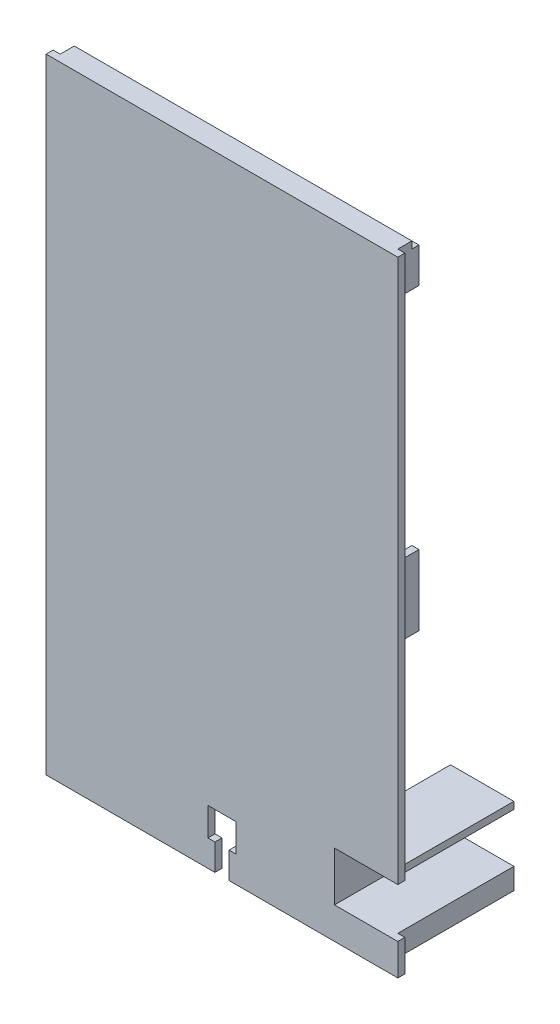
from build123d import *

# Parameters (mm, degrees)
SKETCH1_W           = 100
SKETCH1_H           = 177.5
BOSS_EXTRUDE1_DEPTH = 2
SKETCH3_W           = 2
SKETCH3_H           = 20
BOSS_EXTRUDE2_DEPTH = 6
SKETCH4_W           = 96
SKETCH4_H           = 2
BOSS_EXTRUDE3_DEPTH = 4
BOSS_EXTRUDE5_DEPTH = 33
SKETCH7_W           = 18
SKETCH7_H           = 14
CUT_EXTRUDE2_DEPTH  = 207.386167172
CUT_EXTRUDE3_DEPTH  = 207.386167172


with BuildPart() as part:
    # Sketch1 → Boss-Extrude1 (new body)
    with BuildSketch(Plane.XY):
        with Locations((50, 88.75)):
            Rectangle(SKETCH1_W, SKETCH1_H)
    extrude(amount=BOSS_EXTRUDE1_DEPTH)

    # Sketch3 → Boss-Extrude2 (add)
    with BuildSketch(Plane(origin=(0, 0, 0), x_dir=(-1, 0, 0), z_dir=(0, 0, -1))):
        Polygon((-98, 175.5), (-88, 175.5), (-88, 173.5), (-96, 173.5), (-96, 165.5), (-98, 165.5), align=None)
        Polygon((-12, 175.5), (-2, 175.5), (-2, 165.5), (-4, 165.5), (-4, 173.5), (-12, 173.5), align=None)
        Polygon((-2, 3), (-12, 3), (-12, 5), (-4, 5), (-4, 13), (-2, 13), align=None)
        with Locations((-97, 90.5)):
            Rectangle(SKETCH3_W, SKETCH3_H)
        with Locations((-3, 90.5)):
            Rectangle(SKETCH3_W, SKETCH3_H)
    extrude(amount=BOSS_EXTRUDE2_DEPTH)

    # Sketch4 → Boss-Extrude3 (add)
    with BuildSketch(Plane(origin=(0, 0, 0), x_dir=(-1, 0, 0), z_dir=(0, 0, -1))):
        with Locations((-50, 176.5)):
            Rectangle(SKETCH4_W, SKETCH4_H)
    extrude(amount=BOSS_EXTRUDE3_DEPTH)

    # Sketch5 → Boss-Extrude5 (add)
    with BuildSketch(Plane(origin=(0, 0, 0), x_dir=(-1, 0, 0), z_dir=(0, 0, -1))):
        Polygon((-98, 3), (-80, 3), (-80, 25), (-98, 25), (-98, 23), (-82, 23), (-82, 9), (-98, 9), align=None)
    extrude(amount=BOSS_EXTRUDE5_DEPTH)

    # Sketch7 → Cut-Extrude2 (cut, through all)
    with BuildSketch(Plane(origin=(0, 0, 0), x_dir=(-1, 0, 0), z_dir=(0, 0, -1))):
        with Locations((-91, 16)):
            Rectangle(SKETCH7_W, SKETCH7_H)
    extrude(amount=-CUT_EXTRUDE2_DEPTH, mode=Mode.SUBTRACT)

    # Sketch8 → Cut-Extrude3 (cut, through all)
    with BuildSketch(Plane(origin=(0, 0, 0), x_dir=(-1, 0, 0), z_dir=(0, 0, -1))):
        Polygon((-48, 0), (-48, 7.5), (-46, 7.5), (-46, 15.5), (-54, 15.5), (-54, 7.5), (-52, 7.5), (-52, 0), align=None)
    extrude(amount=-CUT_EXTRUDE3_DEPTH, mode=Mode.SUBTRACT)


solid = part.part
